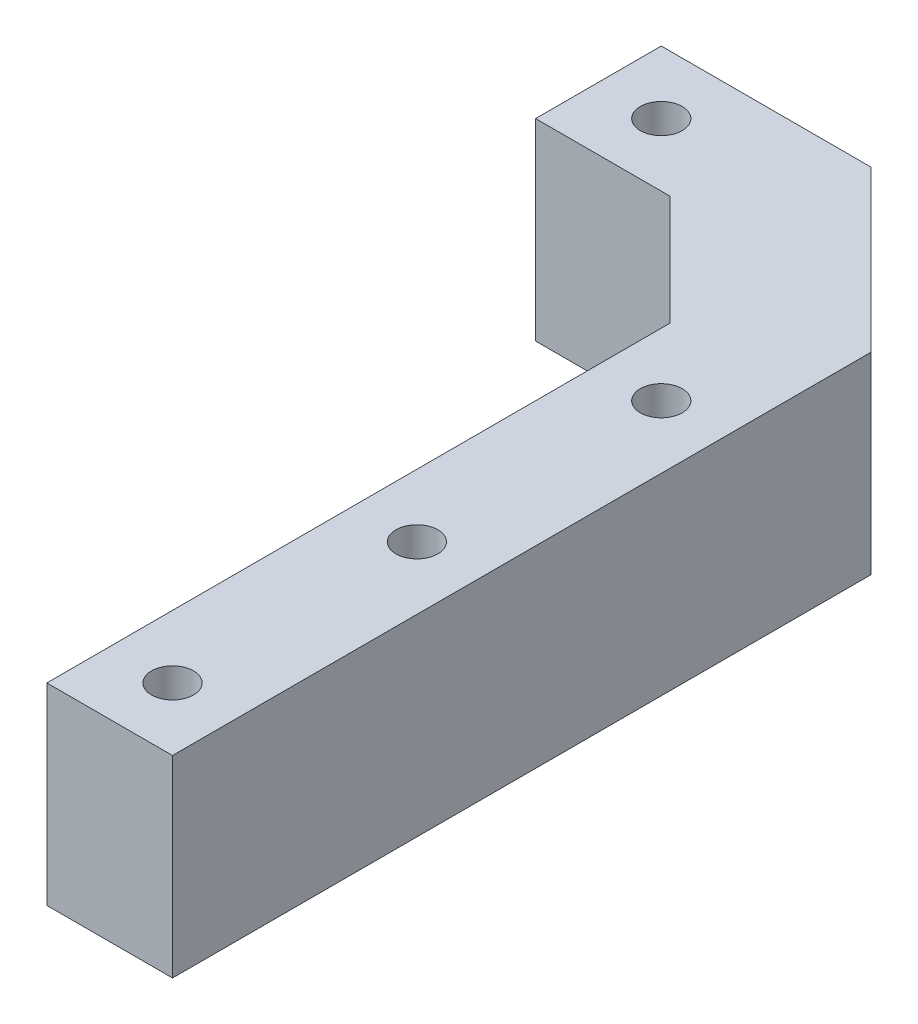
from build123d import *

# Parameters (mm, degrees)
SKETCH_2_R      = 1.5
EXTRUDE_1_DEPTH = 13.8


with BuildPart() as part:
    # 草图2 → 凸台-拉伸1 (new body)
    with BuildSketch(Plane(origin=(0, 0, 0), x_dir=(1, 0, 0), z_dir=(0, 1, 0))):
        Polygon((-39.5, -13), (-39.5, -22), (-29.882405541, -22), (-22, -29.882405541), (-22, -37.5), (-22, -74.5), (-13, -74.5), (-13, -37.5), (-13, -24.468475253), (-24.468475253, -13), align=None)
        with Locations(Location((-35, -17.5, 0), (0, 0, 90))):
            Circle(SKETCH_2_R, mode=Mode.SUBTRACT)
        with Locations(Location((-17.5, -35, 0), (0, 0, 90))):
            Circle(SKETCH_2_R, mode=Mode.SUBTRACT)
        with Locations(Location((-17.5, -52.5, 0), (0, 0, 90))):
            Circle(SKETCH_2_R, mode=Mode.SUBTRACT)
        with Locations(Location((-17.5, -70, 0), (0, 0, 90))):
            Circle(SKETCH_2_R, mode=Mode.SUBTRACT)
    extrude(amount=EXTRUDE_1_DEPTH)


solid = part.part
